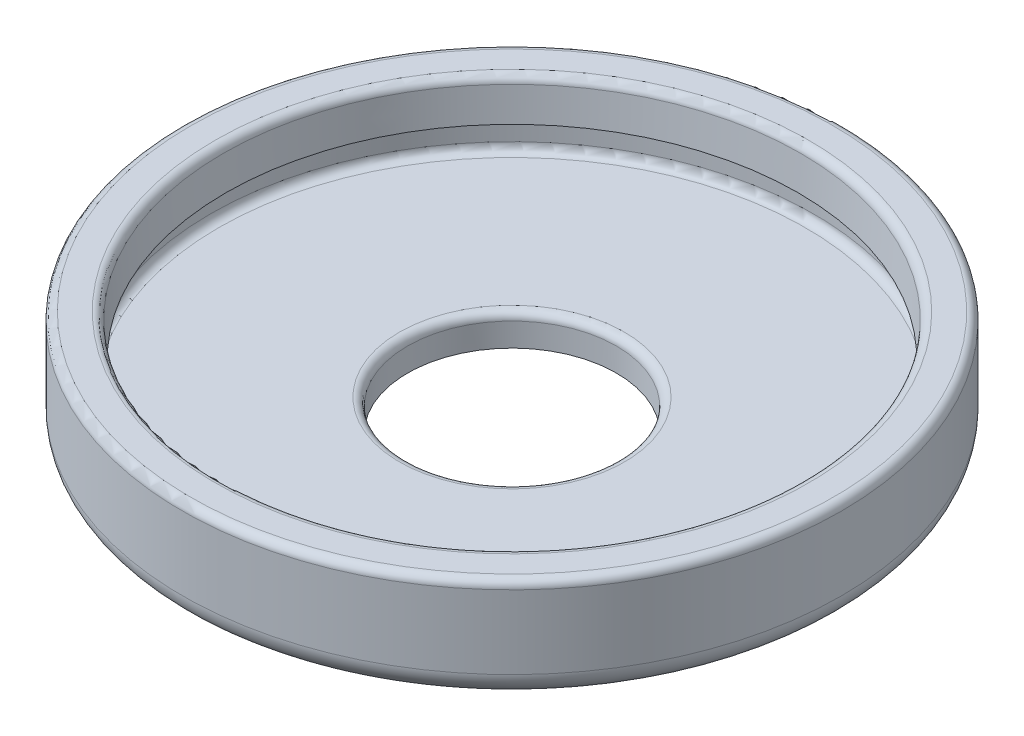
from build123d import *

# Parameters (mm, degrees)
FILLET1_R = 0.381
FILLET2_R = 0.127


with BuildPart() as part:
    # Sketch1 → Revolve1 (revolve)
    with BuildSketch(Plane.XY):
        Polygon((1.651, 0), (5.207, 0), (5.207, 1.667634761), (4.572, 1.667634761), (4.5212, 1.032634761), (4.7625, 1.032634761), (4.7625, 0.49747982), (1.651, 0.49747982), align=None)
    revolve(axis=Axis((0, -34.221434911, 0), (0, 1, 0)))

    # Fillet1
    fillet1_edges = [part.edges().sort_by_distance(p)[0] for p in [
        (-5.207, 0, 0),
    ]]
    fillet(fillet1_edges, radius=FILLET1_R)

    # Fillet2
    fillet2_edges = [part.edges().sort_by_distance(p)[0] for p in [
        (-1.651, 0.49747982, 0),
        (-4.7625, 0.49747982, 0),
        (-4.572, 1.667634761, 0),
        (-5.207, 1.667634761, 0),
    ]]
    fillet(fillet2_edges, radius=FILLET2_R)


solid = part.part
